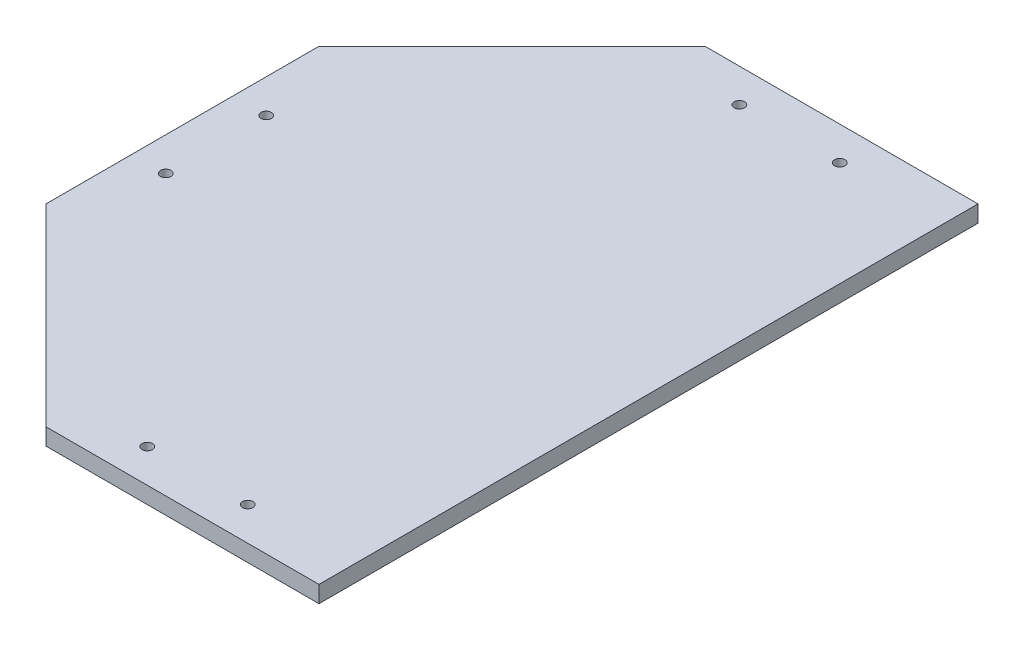
from build123d import *

# Parameters (mm, degrees)
BOSS_EXTRUDE1_DEPTH = 6.35
SKETCH2_R           = 1.995
CUT_EXTRUDE1_DEPTH  = 177.890707783
SKETCH5_R           = 1.995
CUT_EXTRUDE5_DEPTH  = 177.890707783
CUT_EXTRUDE6_DEPTH  = 10


with BuildPart() as part:
    # Sketch1 → Boss-Extrude1 (new body)
    with BuildSketch(Plane(origin=(0, 0, 0), x_dir=(1, 0, 0), z_dir=(0, 1, 0))):
        Polygon((125, 51.776695297), (51.776695297, 125), (-51.776695297, 125), (-125, 51.776695297), (-125, -51.776695297), (-51.776695297, -125), (51.776695297, -125), (125, -51.776695297), align=None)
    extrude(amount=BOSS_EXTRUDE1_DEPTH)

    # Sketch2 → Cut-Extrude1 (cut, through all)
    with BuildSketch(Plane(origin=(0, 6.35, 0), x_dir=(1, 0, 0), z_dir=(0, 1, 0))):
        with Locations(Location((-26.05, -112.3, 0), (0, 0, 270))):
            Circle(SKETCH2_R)
        with Locations(Location((12.05, -112.3, 0), (0, 0, 270))):
            Circle(SKETCH2_R)
        with Locations(Location((12.05, 112.3, 0), (0, 0, 90))):
            Circle(SKETCH2_R)
        with Locations(Location((-26.05, 112.3, 0), (0, 0, 90))):
            Circle(SKETCH2_R)
    extrude(amount=-CUT_EXTRUDE1_DEPTH, mode=Mode.SUBTRACT)

    # Sketch5 → Cut-Extrude5 (cut, through all)
    with BuildSketch(Plane(origin=(0, 6.35, 0), x_dir=(1, 0, 0), z_dir=(0, 1, 0))):
        with Locations(Location((-112.3, 19.05, 0), (0, 0, 270))):
            Circle(SKETCH5_R)
        with Locations(Location((-112.3, -19.05, 0), (0, 0, 270))):
            Circle(SKETCH5_R)
    extrude(amount=-CUT_EXTRUDE5_DEPTH, mode=Mode.SUBTRACT)

    # Sketch6 → Cut-Extrude6 (cut)
    with BuildSketch(Plane(origin=(0, 6.35, 0), x_dir=(1, 0, 0), z_dir=(0, 1, 0))):
        Polygon((51.776695297, -125), (125, -51.776695297), (125, 51.776695297), (51.776695297, 125), align=None)
    extrude(amount=-CUT_EXTRUDE6_DEPTH, mode=Mode.SUBTRACT)


solid = part.part
